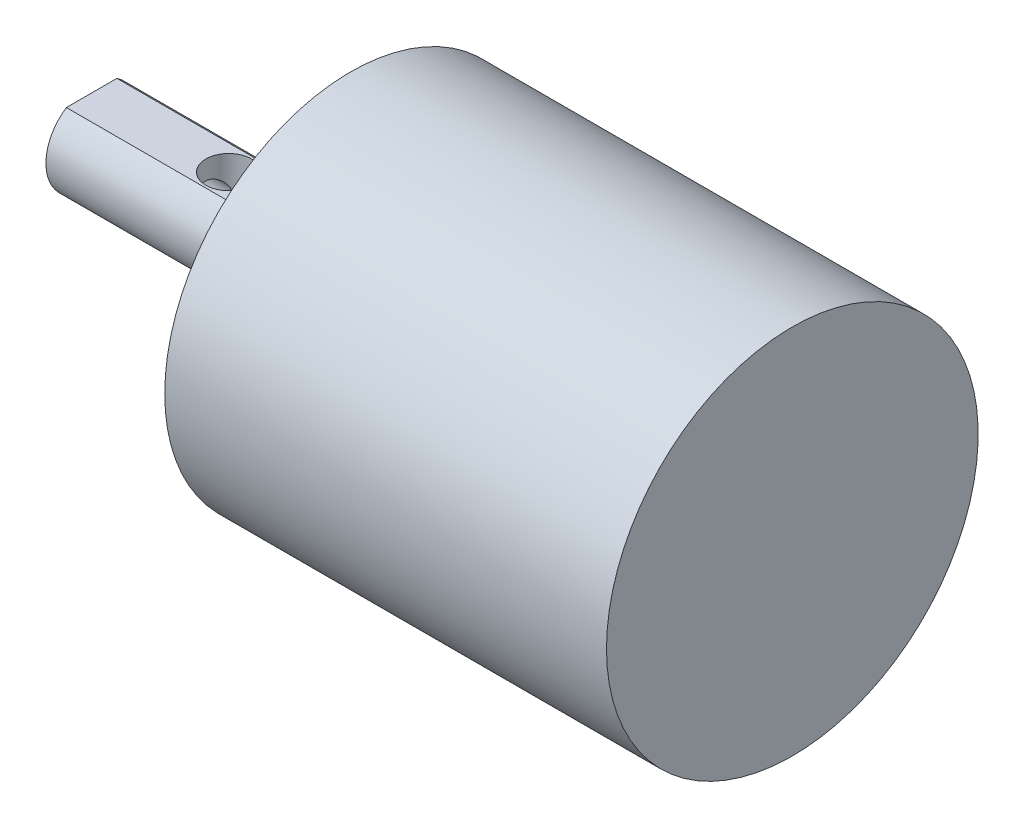
from build123d import *

# Parameters (mm, degrees)
CUT_EXTRUDE_3_DEPTH    = 11.5
HOLE_WIZARD_M3_1_D     = 2.5
HOLE_WIZARD_M3_1_DEPTH = 8
HOLE_WIZARD_M3_1_TIP   = 0.751075774
SKETCH_12_R            = 1.5
CUT_EXTRUDE_4_DEPTH    = 11.5
HOLE_WIZARD_M3_2_D     = 2.5
HOLE_WIZARD_M3_2_DEPTH = 4
HOLE_WIZARD_M3_2_TIP   = 0.751075774
EXTRUDE_START          = 0.5
EXTRUDE_1_DEPTH        = 0.5


with BuildPart() as part:
    # 草图1 → 旋转1 (revolve)
    with BuildSketch(Plane(origin=(0, 0, 0), x_dir=(1, 0, 0), z_dir=(0, 1, 0))):
        Polygon((0, 0), (-29, 0), (-29, 5.7), (-31.6, 5.7), (-31.6, 9.2), (-46, 9.2), (-46, 12.2), (0, 12.2), align=None)
    revolve(axis=Axis((-46, 0, -12.2), (1, 0, 0)))

    # 草图9 → 切除-拉伸3 (cut)
    with BuildSketch(Plane.ZY.offset(46)):
        with BuildLine():
            Line((-12.2, 2.5), (-10.541687605, 2.5))
            ThreePointArc((-10.541687605, 2.5), (-12.2, 3), (-13.858312395, 2.5))
            Line((-13.858312395, 2.5), (-12.2, 2.5))
        make_face()
    extrude(amount=-CUT_EXTRUDE_3_DEPTH, mode=Mode.SUBTRACT)

    # M3 螺纹孔1
    with Locations(Plane.ZY.offset(46)):
        with Locations((-12.2, 0)):
            Hole(HOLE_WIZARD_M3_1_D / 2, depth=HOLE_WIZARD_M3_1_DEPTH)
            with Locations((0, 0, -(HOLE_WIZARD_M3_1_DEPTH + HOLE_WIZARD_M3_1_TIP / 2))):  # 118° drill point
                Cone(0, HOLE_WIZARD_M3_1_D / 2, HOLE_WIZARD_M3_1_TIP, mode=Mode.SUBTRACT)

    # 草图12 → 切除-拉伸4 (cut)
    with BuildSketch(Plane(origin=(0, 2.5, 0), x_dir=(1, 0, 0), z_dir=(0, 1, 0))):
        with Locations(Location((-37, 12.2, 0), (0, 0, 270))):
            Circle(SKETCH_12_R)
    extrude(amount=-CUT_EXTRUDE_4_DEPTH, mode=Mode.SUBTRACT)

    # M3 螺纹孔2
    with Locations(Plane.ZY.offset(29)):
        with Locations((-12.2, 9.5), (-20.427241336, -4.75), (-3.972758664, -4.75)):
            Hole(HOLE_WIZARD_M3_2_D / 2, depth=HOLE_WIZARD_M3_2_DEPTH)
            with Locations((0, 0, -(HOLE_WIZARD_M3_2_DEPTH + HOLE_WIZARD_M3_2_TIP / 2))):  # 118° drill point
                Cone(0, HOLE_WIZARD_M3_2_D / 2, HOLE_WIZARD_M3_2_TIP, mode=Mode.SUBTRACT)

    # 草图16 → 凸台-拉伸1 (add)
    with BuildSketch(Plane.ZY.offset(31.6).offset(EXTRUDE_START)):
        with BuildLine():
            Line((-9.601923789, -1.5), (-12.2, -6))
            ThreePointArc((-12.2, -6), (-8.525765386, 4.74341649), (-18.009475019, -1.5))
            Line((-18.009475019, -1.5), (-14.69206472, 1.670213589))
            ThreePointArc((-14.69206472, 1.670213589), (-10.614007201, 2.546493048), (-9.601923789, -1.5))
        make_face()
    extrude(amount=-EXTRUDE_1_DEPTH)


solid = part.part
